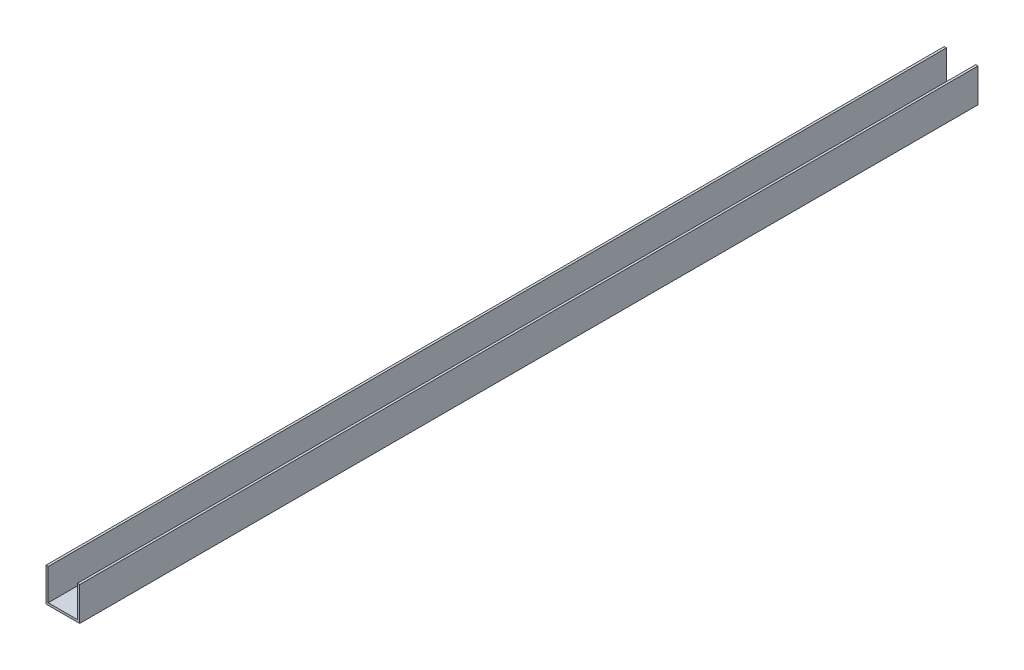
from build123d import *

# Parameters (mm, degrees)
SHEET_EXTRUDE_1_1_BACK  = 400
SHEET_EXTRUDE_1_1_DEPTH = 400
THICKEN_1_T1            = 0.5
THICKEN_1_T2            = 0.5


with BuildPart() as body_1:
    # Sheet Extrude 1: a surface, the sketch's curves swept straight by 400 mm
    with BuildLine(Plane.XY.offset(-SHEET_EXTRUDE_1_1_BACK), mode=Mode.PRIVATE) as sheet_extrude_1_1_path:
        Line((7, 14.5), (7, 0))
        Line((7, 0), (-7, 0))
        Line((-7, 0), (-7, 14.5))
    sheet_extrude_1_1 = Shell.extrude(sheet_extrude_1_1_path.wire(), (0 * SHEET_EXTRUDE_1_1_DEPTH, 0 * SHEET_EXTRUDE_1_1_DEPTH, 1 * SHEET_EXTRUDE_1_1_DEPTH))
    add(Solid.thicken(sheet_extrude_1_1, THICKEN_1_T1))
    add(Solid.thicken(sheet_extrude_1_1, -THICKEN_1_T2))


solid = body_1.part
